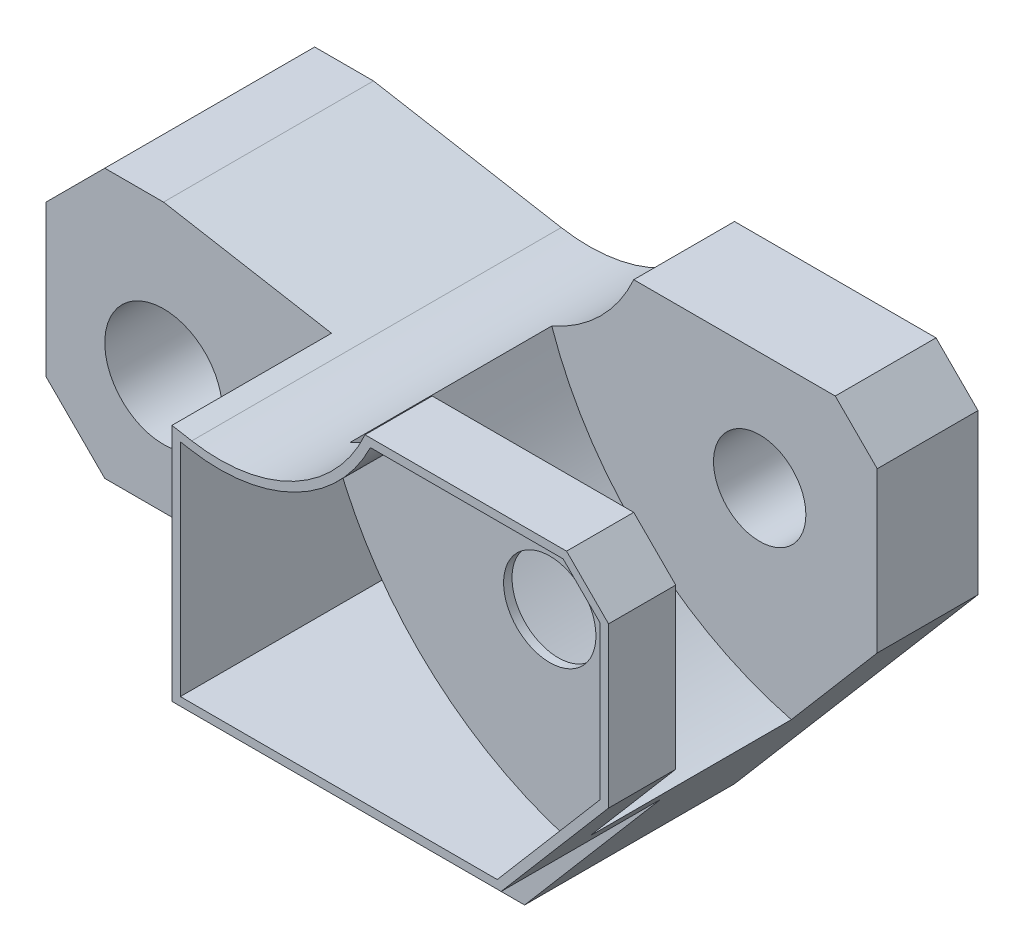
from build123d import *

# Parameters (mm, degrees)
SKETCH1_R               = 7
BOSS_EXTRUDE1_DEPTH     = 44
SKETCH2_R               = 5.5
CUT_EXTRUDE1_DEPTH      = 99.478424033
CUT_EXTRUDE2_DEPTH      = 99.478424033
CUT_EXTRUDE2_DEPTH_BACK = 19
CUT_EXTRUDE3_DEPTH      = 99.478424033
CUT_EXTRUDE3_DEPTH_BACK = 19
CUT_EXTRUDE5_DEPTH      = 24
CUT_EXTRUDE6_DEPTH      = 7
CUT_EXTRUDE7_DEPTH      = 25


with BuildPart() as part:
    # Sketch1 → Boss-Extrude1 (new body)
    with BuildSketch(Plane.XY):
        with BuildLine():
            Line((0, 0), (32.575538911, 0))
            ThreePointArc((32.575538911, 0), (35.840774692, -1.213413768), (37.521177653, -4.264705882))
            ThreePointArc((37.521177653, -4.264705882), (39.858007856, -12.115672061), (44.296980053, -19))
            Line((44.296980053, -19), (50, -19))
            Line((50, -19), (79, 15))
            Line((79, 15), (79, 34))
            Line((79, 34), (74, 39))
            Line((74, 39), (50, 39))
            ThreePointArc((50, 39), (41.561098706, 29.982044142), (29.361380836, 28.057085233))
            Line((29.361380836, 28.057085233), (7, 32))
            Line((7, 32), (0, 32))
            Line((0, 32), (-7, 25))
            Line((-7, 25), (-7, 7))
            Line((-7, 7), (0, 0))
        make_face()
        with Locations((7, 14)):
            Circle(SKETCH1_R, mode=Mode.SUBTRACT)
    extrude(amount=-BOSS_EXTRUDE1_DEPTH)

    # Sketch2 → Cut-Extrude1 (cut, through all)
    with BuildSketch(Plane.XY):
        with Locations((65, 25)):
            Circle(SKETCH2_R)
    extrude(amount=-CUT_EXTRUDE1_DEPTH, mode=Mode.SUBTRACT)

    # Sketch3 → Cut-Extrude2 (cut, two sides: drawn at the far end of the back side and taken through both)
    with BuildSketch(Plane.XY.offset(-CUT_EXTRUDE2_DEPTH_BACK)):
        Polygon((27, 179.295751817), (27, 28.473460386), (27, 0), (27, -150.822291432), (-274.644582863, -150.822291432), (-274.644582863, 179.295751817), align=None)
    extrude(amount=CUT_EXTRUDE2_DEPTH + CUT_EXTRUDE2_DEPTH_BACK, mode=Mode.SUBTRACT)

    # Sketch4 → Cut-Extrude3 (cut, two sides: drawn at the far end of the back side and taken through both)
    with BuildSketch(Plane.XY.offset(-CUT_EXTRUDE3_DEPTH_BACK)):
        Polygon((-143.317212119, 0), (32.575538911, 0), (66.205882353, 0), (242.098633383, 0), (242.098633383, -351.78550206), (-143.317212119, -351.78550206), align=None)
    extrude(amount=CUT_EXTRUDE3_DEPTH + CUT_EXTRUDE3_DEPTH_BACK, mode=Mode.SUBTRACT)

    # Sketch7 → Cut-Extrude5 (cut)
    with BuildSketch(Plane.XY.offset(-8)):
        with BuildLine():
            Line((68.764705882, 3), (79, 15))
            Line((79, 15), (79, 34))
            Line((79, 34), (74, 39))
            Line((74, 39), (50, 39))
            ThreePointArc((50, 39), (46.021244343, 33.259333621), (40.236936549, 29.344294617))
            ThreePointArc((40.236936549, 29.344294617), (51.184262982, 12.580705229), (68.764705882, 3))
        make_face()
    extrude(amount=-CUT_EXTRUDE5_DEPTH, mode=Mode.SUBTRACT)

    # Sketch8 → Cut-Extrude6 (cut)
    with BuildSketch(Plane.XY):
        with BuildLine():
            Line((28, 1), (65.744476296, 1))
            Line((65.744476296, 1), (78, 15.368545033))
            Line((78, 15.368545033), (78, 33.585786438))
            Line((78, 33.585786438), (73.585786438, 38))
            Line((73.585786438, 38), (50.636084685, 38))
            ThreePointArc((50.636084685, 38), (41.740005768, 28.948047079), (29.187732658, 27.07227748))
            Line((29.187732658, 27.07227748), (28, 27.281706793))
            Line((28, 27.281706793), (28, 1))
        make_face()
    extrude(amount=-CUT_EXTRUDE6_DEPTH, mode=Mode.SUBTRACT)

    # Sketch9 → Cut-Extrude7 (cut)
    with BuildSketch(Plane.XY.offset(-7)):
        with BuildLine():
            ThreePointArc((66.986847747, 2.456573425), (50.310181683, 12.027872638), (39.646682943, 28.028208705))
            ThreePointArc((39.646682943, 28.028208705), (34.481076416, 26.851449437), (29.187732658, 27.07227748))
            Line((29.187732658, 27.07227748), (28, 27.281706793))
            Line((28, 27.281706793), (28, 1))
            Line((28, 1), (65.744476296, 1))
            Line((65.744476296, 1), (66.986847747, 2.456573425))
        make_face()
    extrude(amount=-CUT_EXTRUDE7_DEPTH, mode=Mode.SUBTRACT)


solid = part.part
